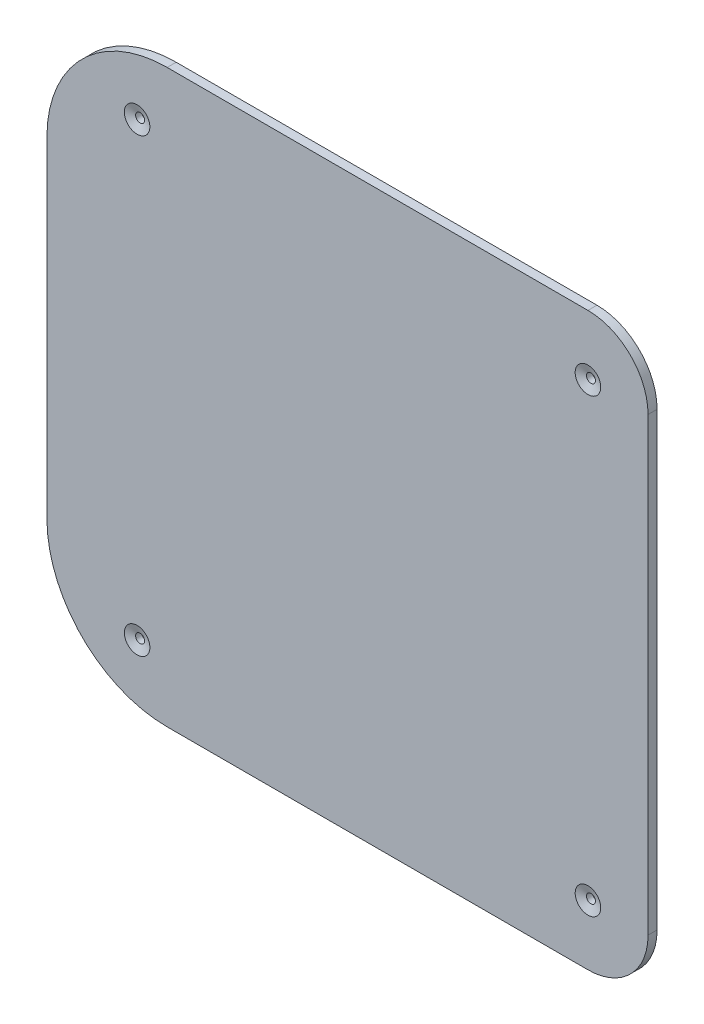
from build123d import *
from OCP.BRepFilletAPI import BRepFilletAPI_MakeChamfer

# Parameters (mm, degrees)
BASE_DEPTH                   = 3
SKETCH2_R                    = 1.5
SCREWHOLES_DEPTH             = 138.963763358
CHAMFER1_SIZE                = 1
CHAMFER1_SIZE2               = 2.747477419
SKETCH3_W                    = 10
SKETCH3_H                    = 55
ARDUINORISERS_DEPTH          = 4
SKETCH4_W                    = 10
SKETCH4_H                    = 1.5
ARDUINOCLAMPSSIDE_DEPTH      = 10
ARDUINOCLAMPSCATCHERS1_DEPTH = 10
ARDUINOCLAMPSCATCHERS2_DEPTH = 10
SKETCH7_W                    = 10
SKETCH7_H                    = 11
ISPSPACE_DEPTH               = 4


with BuildPart() as part:
    # Sketch1 → base (new body)
    with BuildSketch(Plane.XY):
        with BuildLine():
            Line((80, 95), (-60, 95))
            ThreePointArc((-60, 95), (-88.284271247, 83.284271247), (-100, 55))
            Line((-100, 55), (-100, -55))
            ThreePointArc((-100, -55), (-88.284271247, -83.284271247), (-60, -95))
            Line((-60, -95), (80, -95))
            ThreePointArc((80, -95), (94.142135624, -89.142135624), (100, -75))
            Line((100, -75), (100, 75))
            ThreePointArc((100, 75), (94.142135624, 89.142135624), (80, 95))
        make_face()
    extrude(amount=BASE_DEPTH)

    # Sketch2 → screwHoles (cut, through all)
    with BuildSketch(Plane(origin=(0, 0, 0), x_dir=(-1, 0, 0), z_dir=(0, 0, -1))):
        with Locations((-80, 75)):
            Circle(SKETCH2_R)
        with Locations((-80, -75)):
            Circle(SKETCH2_R)
        with Locations((70, -75)):
            Circle(SKETCH2_R)
        with Locations((70, 75)):
            Circle(SKETCH2_R)
    extrude(amount=-SCREWHOLES_DEPTH, mode=Mode.SUBTRACT)

    # Chamfer1: one chamfer whose edges measure the first distance from different faces: ONE call of the kernel's chamfer builder (chamfer() names one face for all edges)
    chamfer1_edges_1 = [part.edges().sort_by_distance(p)[0] for p in [
        (81.5, 75, 3),
    ]]
    chamfer1_side_1 = [part.faces().sort_by_distance(p)[0] for p in [
        (81.5, 75, 1.5),
    ]]
    chamfer1_edges_2 = [part.edges().sort_by_distance(p)[0] for p in [
        (81.5, -75, 3),
    ]]
    chamfer1_side_2 = [part.faces().sort_by_distance(p)[0] for p in [
        (81.5, -75, 1.5),
    ]]
    chamfer1_edges_3 = [part.edges().sort_by_distance(p)[0] for p in [
        (-68.5, -75, 3),
    ]]
    chamfer1_side_3 = [part.faces().sort_by_distance(p)[0] for p in [
        (-68.5, -75, 1.5),
    ]]
    chamfer1_edges_4 = [part.edges().sort_by_distance(p)[0] for p in [
        (-68.5, 75, 3),
    ]]
    chamfer1_side_4 = [part.faces().sort_by_distance(p)[0] for p in [
        (-68.5, 75, 1.5),
    ]]
    chamfer1 = BRepFilletAPI_MakeChamfer(part.part.solid().wrapped)
    for e in chamfer1_edges_1:
        chamfer1.Add(CHAMFER1_SIZE, CHAMFER1_SIZE2, e.wrapped, chamfer1_side_1[0].wrapped)  # the first distance lies on this face
    for e in chamfer1_edges_2:
        chamfer1.Add(CHAMFER1_SIZE, CHAMFER1_SIZE2, e.wrapped, chamfer1_side_2[0].wrapped)  # the first distance lies on this face
    for e in chamfer1_edges_3:
        chamfer1.Add(CHAMFER1_SIZE, CHAMFER1_SIZE2, e.wrapped, chamfer1_side_3[0].wrapped)  # the first distance lies on this face
    for e in chamfer1_edges_4:
        chamfer1.Add(CHAMFER1_SIZE, CHAMFER1_SIZE2, e.wrapped, chamfer1_side_4[0].wrapped)  # the first distance lies on this face
    add(Compound.cast(chamfer1.Shape()), mode=Mode.REPLACE)

    # Sketch3 → arduinoRisers (add)
    with BuildSketch(Plane(origin=(0, 0, 0), x_dir=(-1, 0, 0), z_dir=(0, 0, -1))):
        with Locations((-76, -12)):
            Rectangle(SKETCH3_W, SKETCH3_H)
        with Locations((-33.5, -12)):
            Rectangle(SKETCH3_W, SKETCH3_H)
    extrude(amount=ARDUINORISERS_DEPTH)

    # Sketch4 → arduinoClampsSide (add)
    with BuildSketch(Plane(origin=(0, 0, 0), x_dir=(-1, 0, 0), z_dir=(0, 0, -1))):
        with Locations((-76, -40.25)):
            Rectangle(SKETCH4_W, SKETCH4_H)
        with Locations((-33.5, -40.25)):
            Rectangle(SKETCH4_W, SKETCH4_H)
        with Locations((-76, 16.25)):
            Rectangle(SKETCH4_W, SKETCH4_H)
        with Locations((-33.5, 16.25)):
            Rectangle(SKETCH4_W, SKETCH4_H)
    extrude(amount=ARDUINOCLAMPSSIDE_DEPTH)

    # Sketch5 → arduinoClampsCatchers1 (add)
    with BuildSketch(Plane(origin=(81, 0, 0), x_dir=(0, 0, -1), z_dir=(1, 0, 0))):
        with BuildLine():
            Line((5, 15.5), (8.712652114, 14.386204366))
            ThreePointArc((8.712652114, 14.386204366), (9.59693053, 14.541737723), (10, 15.344030651))
            Line((10, 15.344030651), (10, 15.5))
            Line((10, 15.5), (5, 15.5))
        make_face()
        with BuildLine():
            Line((5, -39.5), (8.712652114, -38.386204366))
            ThreePointArc((8.712652114, -38.386204366), (9.59693053, -38.541737723), (10, -39.344030651))
            Line((10, -39.344030651), (10, -39.5))
            Line((10, -39.5), (5, -39.5))
        make_face()
    extrude(amount=-ARDUINOCLAMPSCATCHERS1_DEPTH)

    # Sketch6 → arduinoClampsCatchers2 (add)
    with BuildSketch(Plane(origin=(38.5, 0, 0), x_dir=(0, 0, -1), z_dir=(1, 0, 0))):
        with BuildLine():
            Line((5, 15.5), (8.712652114, 14.386204366))
            ThreePointArc((8.712652114, 14.386204366), (9.59693053, 14.541737723), (10, 15.344030651))
            Line((10, 15.344030651), (10, 15.5))
            Line((10, 15.5), (5, 15.5))
        make_face()
        with BuildLine():
            Line((8.712652114, -38.386204366), (5, -39.5))
            Line((5, -39.5), (10, -39.5))
            Line((10, -39.5), (10, -39.344030651))
            ThreePointArc((10, -39.344030651), (9.59693053, -38.541737723), (8.712652114, -38.386204366))
        make_face()
    extrude(amount=-ARDUINOCLAMPSCATCHERS2_DEPTH)

    # Sketch7 → ISPspace (cut)
    with BuildSketch(Plane(origin=(0, 0, -4), x_dir=(-1, 0, 0), z_dir=(0, 0, -1))):
        with Locations((-33.5, -11)):
            Rectangle(SKETCH7_W, SKETCH7_H)
    extrude(amount=-ISPSPACE_DEPTH, mode=Mode.SUBTRACT)


solid = part.part
